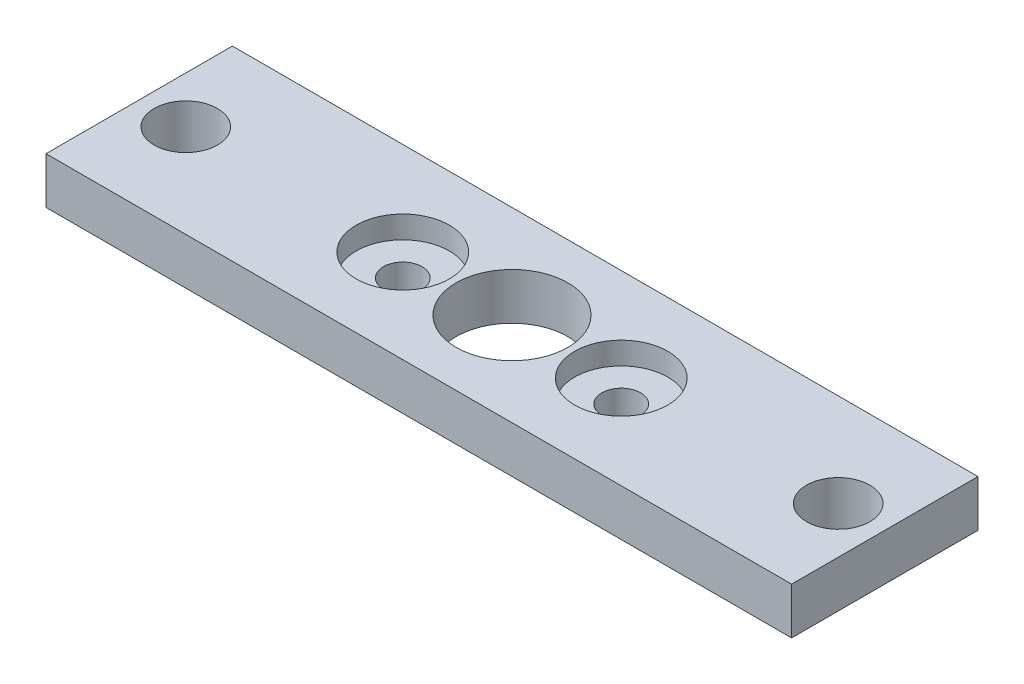
from build123d import *

# Parameters (mm, degrees)
SKETCH1_W           = 50.8
SKETCH1_H           = 12.7
SKETCH1_R           = 3.81
SKETCH1_R_2         = 1.3208
SKETCH1_R_3         = 2.159
BOSS_EXTRUDE1_DEPTH = 3.175
SKETCH2_R           = 3.175
CUT_EXTRUDE1_DEPTH  = 1.524


with BuildPart() as part:
    # Sketch1 → Boss-Extrude1 (new body)
    with BuildSketch(Plane(origin=(0, 0, 0), x_dir=(1, 0, 0), z_dir=(0, 1, 0))):
        Rectangle(SKETCH1_W, SKETCH1_H)
        with Locations(Location((0, 0, 0), (0, 0, 270))):
            Circle(SKETCH1_R, mode=Mode.SUBTRACT)
        with Locations(Location((7.4422, 0, 0), (0, 0, 270))):
            Circle(SKETCH1_R_2, mode=Mode.SUBTRACT)
        with Locations(Location((-7.4422, 0, 0), (0, 0, 270))):
            Circle(SKETCH1_R_2, mode=Mode.SUBTRACT)
        with Locations(Location((-22.225, 0, 0), (0, 0, 270))):
            Circle(SKETCH1_R_3, mode=Mode.SUBTRACT)
        with Locations(Location((22.225, 0, 0), (0, 0, 270))):
            Circle(SKETCH1_R_3, mode=Mode.SUBTRACT)
    extrude(amount=BOSS_EXTRUDE1_DEPTH)

    # Sketch2 → Cut-Extrude1 (cut)
    with BuildSketch(Plane(origin=(0, 3.175, 0), x_dir=(1, 0, 0), z_dir=(0, 1, 0))):
        with Locations(Location((-7.4422, 0, 0), (0, 0, 270))):
            Circle(SKETCH2_R)
        with Locations(Location((7.4422, 0, 0), (0, 0, 270))):
            Circle(SKETCH2_R)
    extrude(amount=-CUT_EXTRUDE1_DEPTH, mode=Mode.SUBTRACT)


solid = part.part
